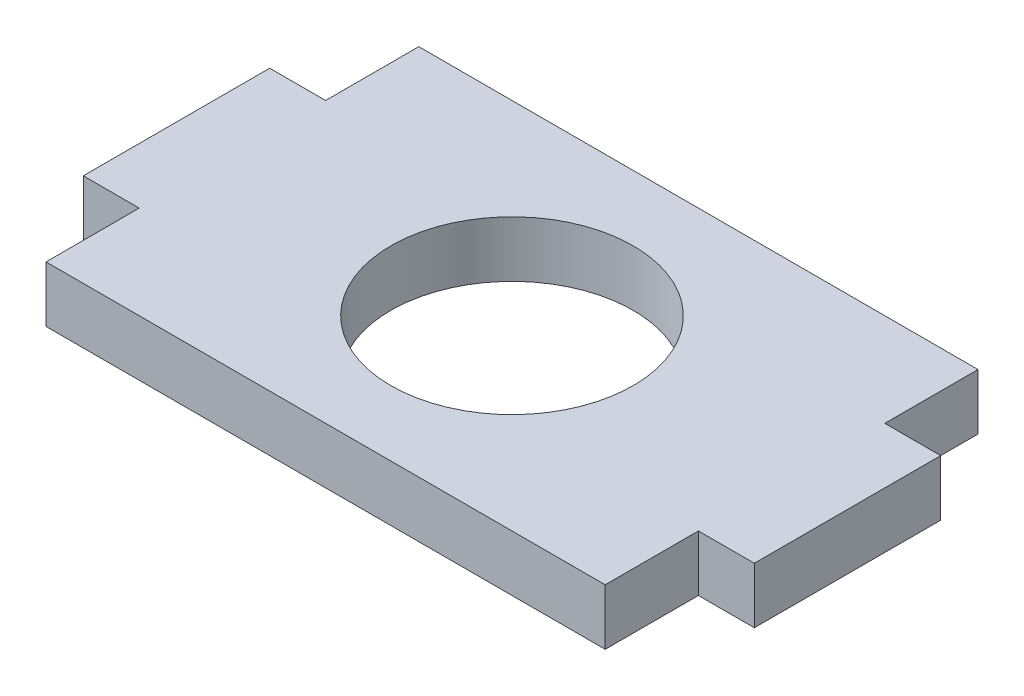
from build123d import *

# Parameters (mm, degrees)
CROQUIS1_R              = 6.5
SALIENTE_EXTRUIR1_DEPTH = 3


with BuildPart() as part:
    # Croquis1 → Saliente-Extruir1 (new body)
    with BuildSketch(Plane(origin=(0, 0, 0), x_dir=(1, 0, 0), z_dir=(0, 1, 0))):
        Polygon((0, -5), (0, 5), (3, 5), (3, 10), (33, 10), (33, 5), (36, 5), (36, -5), (33, -5), (33, -10), (3, -10), (3, -5), align=None)
        with Locations(Location((18, 0, 0), (0, 0, 270))):
            Circle(CROQUIS1_R, mode=Mode.SUBTRACT)
    extrude(amount=SALIENTE_EXTRUIR1_DEPTH)


solid = part.part
